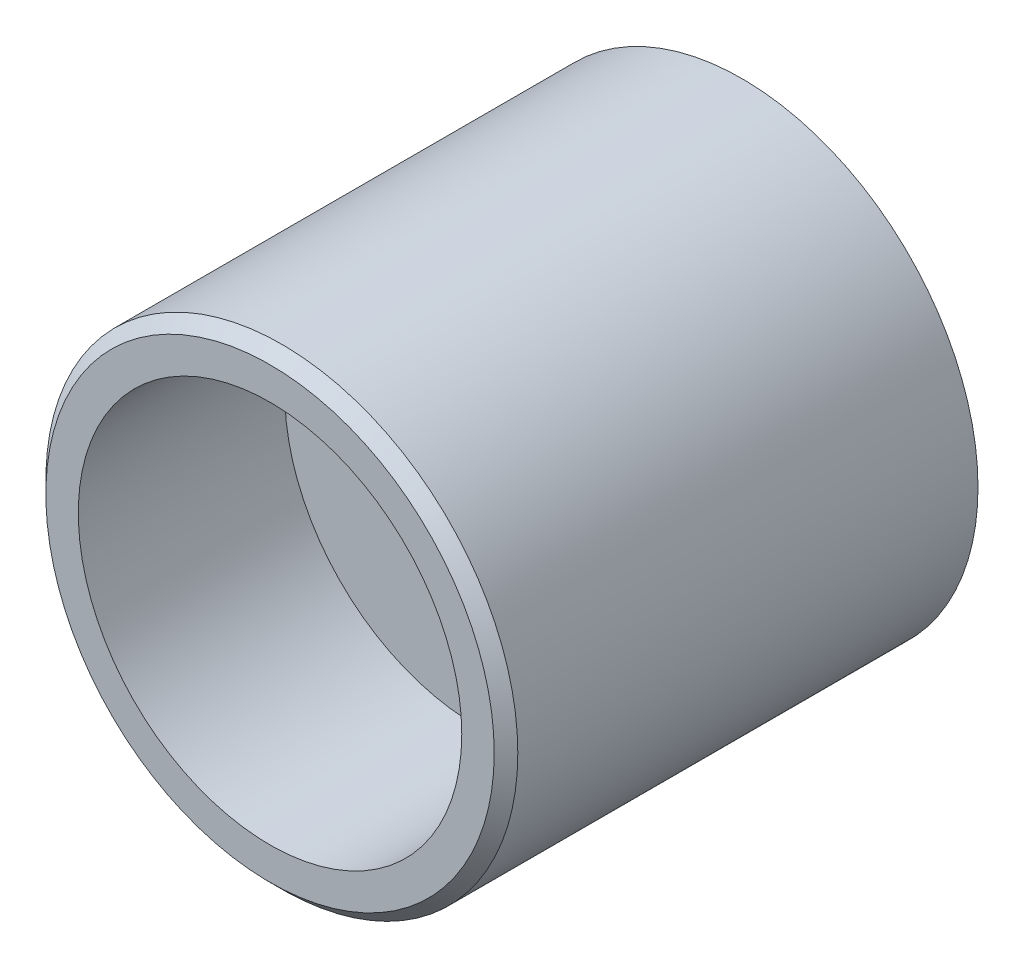
from build123d import *

# Parameters (mm, degrees)
ESQUISSE1_R                                        = 4
BOSS_EXTRU_1_DEPTH                                 = 8
CHAMBRAGE_POUR_VIS_T_TE_HEXAGONALE_M31_D           = 3.4
CHAMBRAGE_POUR_VIS_T_TE_HEXAGONALE_M31_CBORE_D     = 6.5
CHAMBRAGE_POUR_VIS_T_TE_HEXAGONALE_M31_CBORE_DEPTH = 3.5
CHANFREIN1_SIZE                                    = 0.2


with BuildPart() as part:
    # Esquisse1 → Boss.-Extru.1 (new body)
    with BuildSketch(Plane.XY):
        Circle(ESQUISSE1_R)
    extrude(amount=BOSS_EXTRU_1_DEPTH)

    # Chambrage pour vis à tête hexagonale M31 (through all)
    with Locations(Plane.XY.offset(8)):
        with Locations((0, 0)):
            CounterBoreHole(CHAMBRAGE_POUR_VIS_T_TE_HEXAGONALE_M31_D / 2, CHAMBRAGE_POUR_VIS_T_TE_HEXAGONALE_M31_CBORE_D / 2, CHAMBRAGE_POUR_VIS_T_TE_HEXAGONALE_M31_CBORE_DEPTH)

    # Chanfrein1
    chanfrein1_edges = [part.edges().sort_by_distance(p)[0] for p in [
        (-4, 0, 8),
    ]]
    chamfer(chanfrein1_edges, length=CHANFREIN1_SIZE)


solid = part.part
